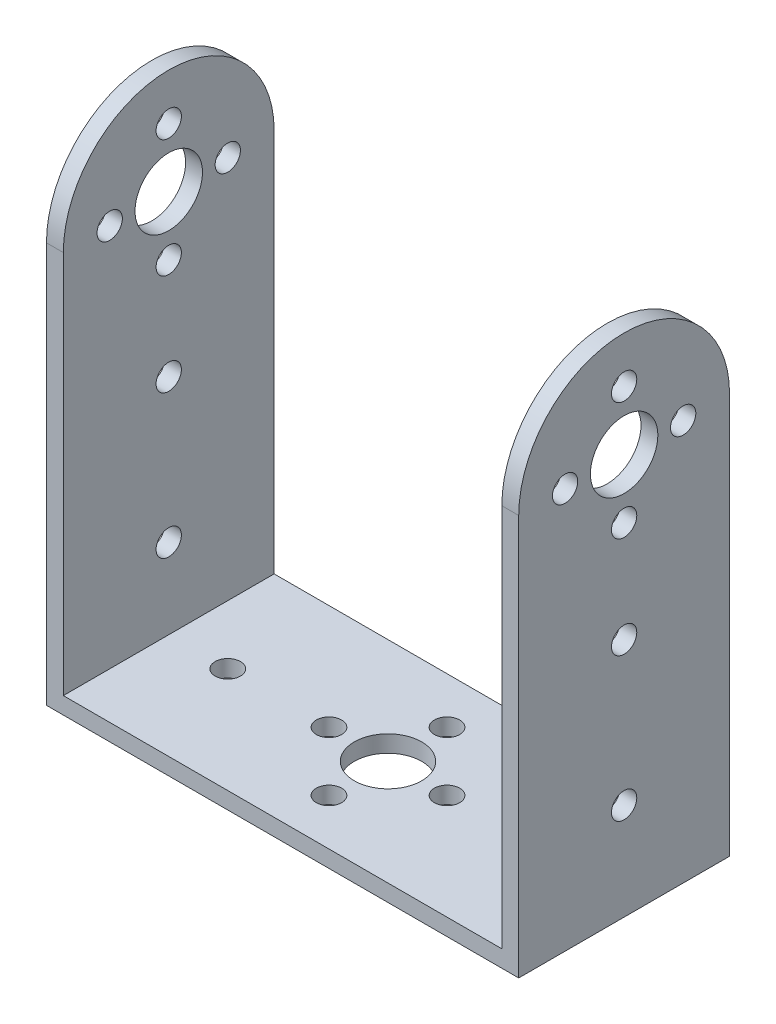
from build123d import *

# Parameters (mm, degrees)
BOSS_EXTRUDE1_DEPTH = 25
SKETCH2_R           = 4
SKETCH2_R_2         = 1.5
CUT_EXTRUDE1_DEPTH  = 69.271516755
SKETCH3_R           = 4
SKETCH3_R_2         = 1.5
CUT_EXTRUDE2_DEPTH  = 71.774289117


with BuildPart() as part:
    # Sketch1 → Boss-Extrude1 (new body)
    with BuildSketch(Plane.XY):
        Polygon((-26, 30), (-26, -28), (26, -28), (26, 30), (28, 30), (28, -30), (-28, -30), (-28, 30), align=None)
    extrude(amount=BOSS_EXTRUDE1_DEPTH)

    # Sketch2 → Cut-Extrude1 (cut, through all)
    with BuildSketch(Plane(origin=(28, 0, 0), x_dir=(0, 0, -1), z_dir=(1, 0, 0))):
        with Locations((-12.5, 17.5)):
            Circle(SKETCH2_R)
        with Locations((-19.5, 17.5)):
            Circle(SKETCH2_R_2)
        with Locations((-12.5, -1.5)):
            Circle(SKETCH2_R_2)
        with Locations((-12.5, -18.5)):
            Circle(SKETCH2_R_2)
        with Locations((-12.5, 24.5)):
            Circle(SKETCH2_R_2)
        with Locations((-5.5, 17.5)):
            Circle(SKETCH2_R_2)
        with Locations((-12.5, 10.5)):
            Circle(SKETCH2_R_2)
        with BuildLine():
            Line((-25, 17.5), (-25, 33.655619926))
            Line((-25, 33.655619926), (0, 33.655619926))
            Line((0, 33.655619926), (0, 17.5))
            ThreePointArc((0, 17.5), (-12.5, 30), (-25, 17.5))
        make_face()
    extrude(amount=-CUT_EXTRUDE1_DEPTH, mode=Mode.SUBTRACT)

    # Sketch3 → Cut-Extrude2 (cut, through all)
    with BuildSketch(Plane.XZ.offset(30)):
        with Locations(Location((0, 12.5, 0), (0, 0, 270))):
            Circle(SKETCH3_R)
        with Locations(Location((-7, 12.5, 0), (0, 0, 270))):
            Circle(SKETCH3_R_2)
        with Locations(Location((0, 19.5, 0), (0, 0, 270))):
            Circle(SKETCH3_R_2)
        with Locations(Location((7, 12.5, 0), (0, 0, 270))):
            Circle(SKETCH3_R_2)
        with Locations(Location((0, 5.5, 0), (0, 0, 270))):
            Circle(SKETCH3_R_2)
        with Locations(Location((-19, 12.5, 0), (0, 0, 270))):
            Circle(SKETCH3_R_2)
        with Locations(Location((19, 12.5, 0), (0, 0, 270))):
            Circle(SKETCH3_R_2)
    extrude(amount=-CUT_EXTRUDE2_DEPTH, mode=Mode.SUBTRACT)


solid = part.part
